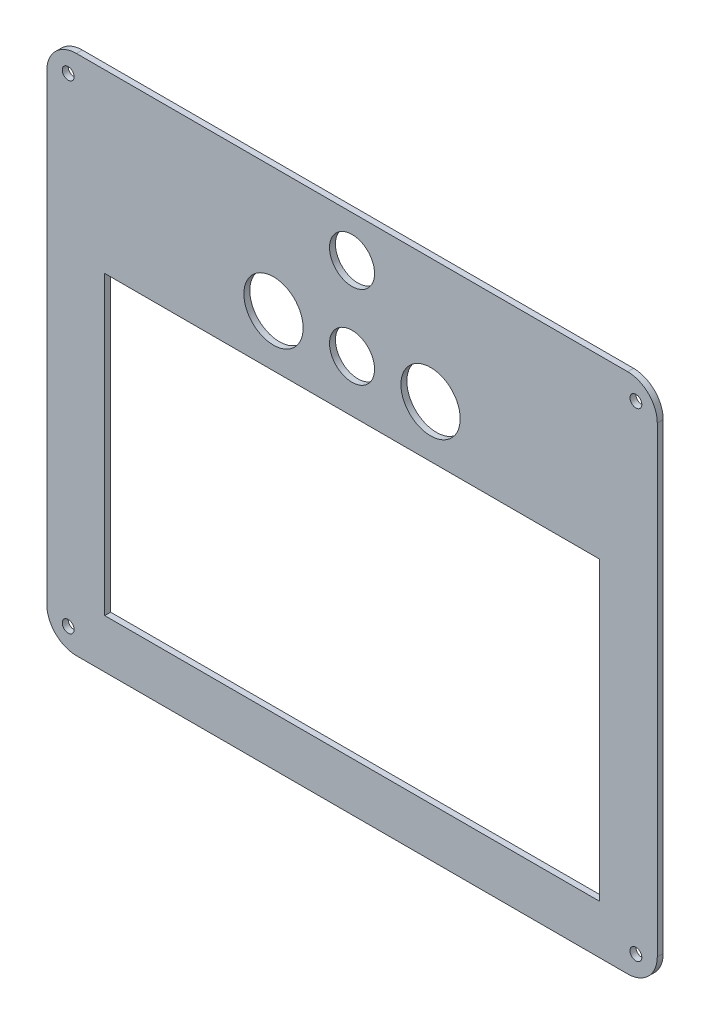
from build123d import *

# Parameters (mm, degrees)
SKETCH1_W           = 206
SKETCH1_H           = 176
BOSS_EXTRUDE1_DEPTH = 2
FILLET1_R           = 10
SKETCH2_R           = 2
CUT_EXTRUDE1_DEPTH  = 5
SKETCH3_R           = 7.6
SKETCH3_R_2         = 10
CUT_EXTRUDE2_DEPTH  = 5
SKETCH4_W           = 83.45
SKETCH4_H           = 100
CUT_EXTRUDE3_DEPTH  = 10


with BuildPart() as part:
    # Sketch1 → Boss-Extrude1 (new body)
    with BuildSketch(Plane.XY):
        with Locations((103, -88)):
            Rectangle(SKETCH1_W, SKETCH1_H)
    extrude(amount=BOSS_EXTRUDE1_DEPTH)

    # Fillet1
    fillet1_edges = [part.edges().sort_by_distance(p)[0] for p in [
        (0, 0, 1),
        (206, 0, 1),
        (206, -176, 1),
        (0, -176, 1),
    ]]
    fillet(fillet1_edges, radius=FILLET1_R)

    # Sketch2 → Cut-Extrude1 (cut)
    with BuildSketch(Plane(origin=(0, 0, 0), x_dir=(-1, 0, 0), z_dir=(0, 0, -1))):
        with Locations((-198.78553391, -7.21446609)):
            Circle(SKETCH2_R)
        with Locations((-7.21446609, -7.21446609)):
            Circle(SKETCH2_R)
        with Locations((-7.21446609, -168.78553391)):
            Circle(SKETCH2_R)
        with Locations((-198.78553391, -168.78553391)):
            Circle(SKETCH2_R)
    extrude(amount=-CUT_EXTRUDE1_DEPTH, mode=Mode.SUBTRACT)

    # Sketch3 → Cut-Extrude2 (cut)
    with BuildSketch(Plane(origin=(0, 0, 0), x_dir=(-1, 0, 0), z_dir=(0, 0, -1))):
        with Locations((-103, -14)):
            Circle(SKETCH3_R)
        with Locations((-129.5, -42)):
            Circle(SKETCH3_R_2)
        with Locations((-103, -42)):
            Circle(SKETCH3_R)
        with Locations((-76.5, -42)):
            Circle(SKETCH3_R_2)
    extrude(amount=-CUT_EXTRUDE2_DEPTH, mode=Mode.SUBTRACT)

    # Sketch4 → Cut-Extrude3 (cut)
    with BuildSketch(Plane.XY.offset(2)):
        with Locations((61.275, -109.5)):
            Rectangle(SKETCH4_W, SKETCH4_H)
        with Locations((144.725, -109.5)):
            Rectangle(SKETCH4_W, SKETCH4_H)
    extrude(amount=-CUT_EXTRUDE3_DEPTH, mode=Mode.SUBTRACT)


solid = part.part
